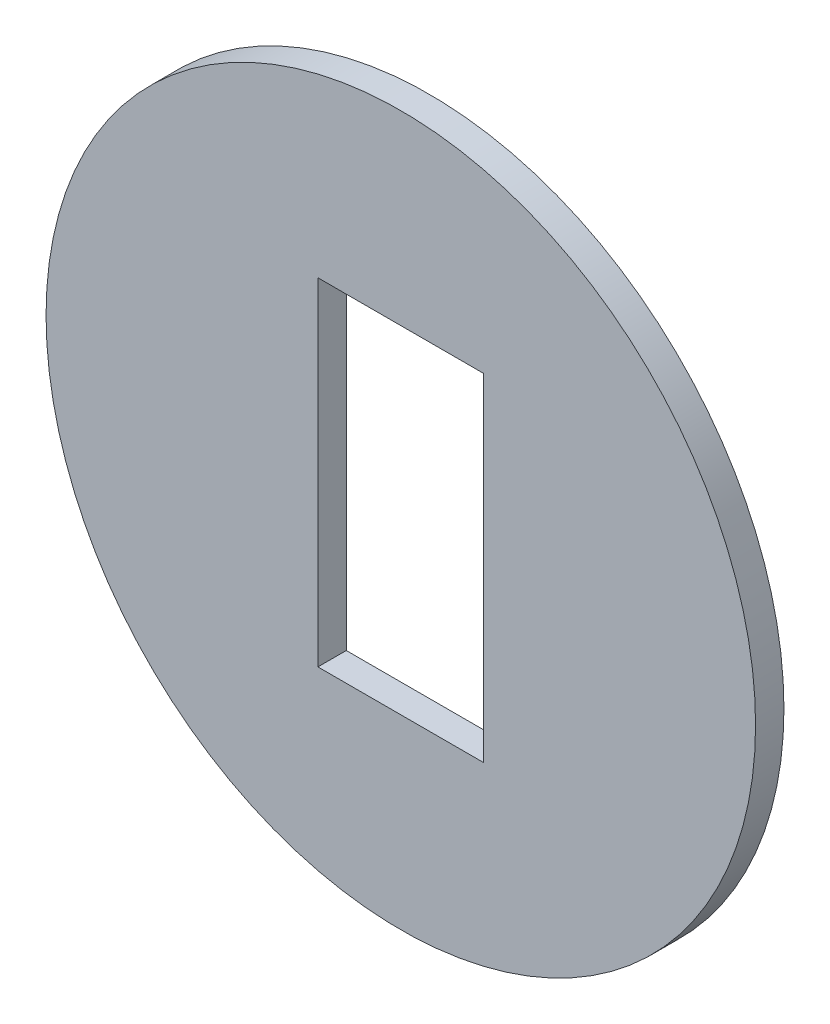
from build123d import *

# Parameters (mm, degrees)
ESQUISSE1_R             = 25
BOSS_EXTRU_1_DEPTH      = 2
ENL_V_MAT_EXTRU_1_REACH = 37.412
ESQUISSE2_W             = 11.684
ESQUISSE2_H             = 23.749


with BuildPart() as part:
    # Esquisse1 → Boss.-Extru.1 (new body)
    with BuildSketch(Plane.XY):
        Circle(ESQUISSE1_R)
    extrude(amount=BOSS_EXTRU_1_DEPTH)

    # Esquisse2 → Enlèv. mat.-Extru.1 (cut, up to next)
    with BuildSketch(Plane.XY.offset(2), mode=Mode.PRIVATE) as enl_v_mat_extru_1_sk1:
        Rectangle(ESQUISSE2_W, ESQUISSE2_H)
    enl_v_mat_extru_1_tool1 = extrude(enl_v_mat_extru_1_sk1.sketch, amount=-ENL_V_MAT_EXTRU_1_REACH, mode=Mode.PRIVATE) & part.part
    add(enl_v_mat_extru_1_tool1.solids().sort_by_distance((0, 0, 2))[0], mode=Mode.SUBTRACT)


solid = part.part
